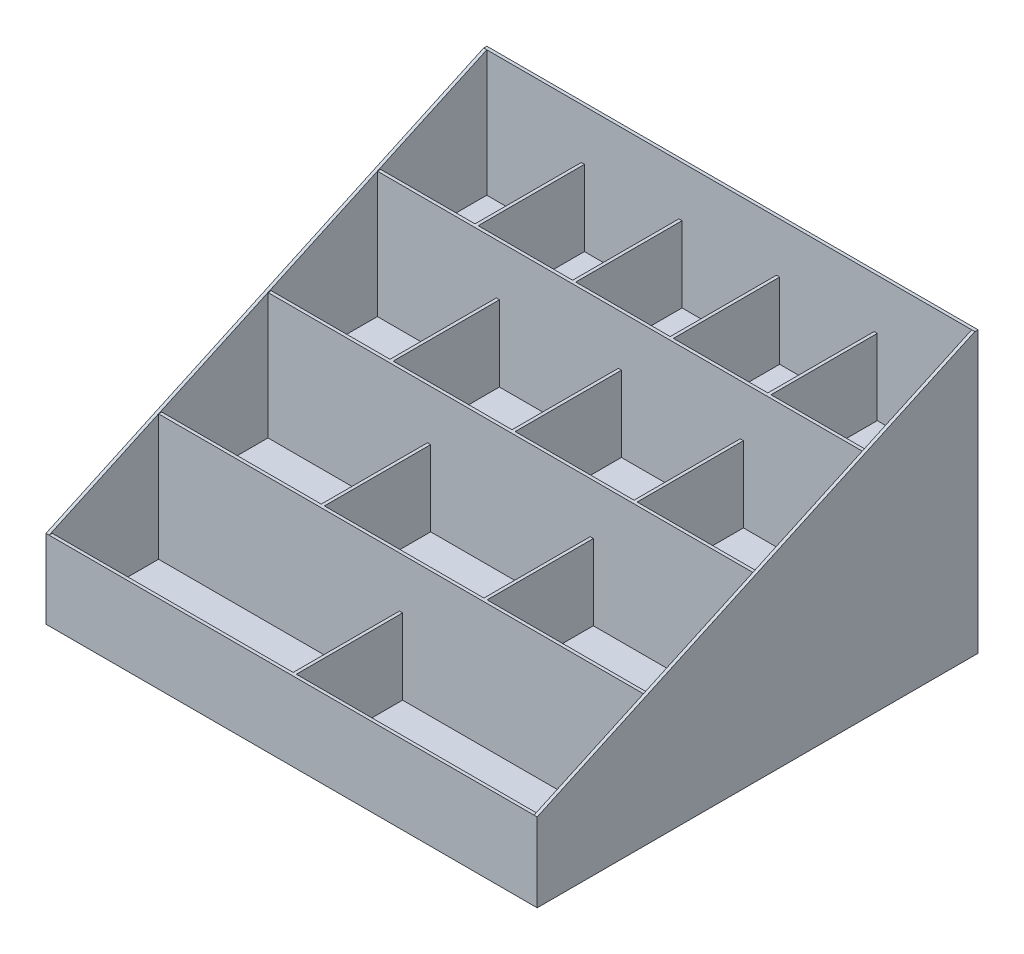
from build123d import *

# Parameters (mm, degrees)
BOSS_EXTRUDE1_DEPTH = 123.825
SKETCH3_W           = 121.44375
SKETCH3_H           = 53.578125
CUT_EXTRUDE1_DEPTH  = 38.1
SKETCH4_W           = 80.433333333
SKETCH4_H           = 53.578125
SKETCH4_W_2         = 80.433333334
CUT_EXTRUDE2_DEPTH  = 38.1
SKETCH5_W           = 59.928125
SKETCH5_H           = 53.578125
CUT_EXTRUDE3_DEPTH  = 38.1
SKETCH6_W           = 47.625
SKETCH6_H           = 53.578125
CUT_EXTRUDE4_DEPTH  = 38.1
BOSS_EXTRUDE2_DEPTH = 1.5875


with BuildPart() as part:
    # Sketch1 → Boss-Extrude1 (new, symmetric)
    with BuildSketch(Plane(origin=(0, 0, 0), x_dir=(0, 0, -1), z_dir=(1, 0, 0))):
        Polygon((0, 0), (222.25, 0), (222.25, 115.8875), (222.25, 141.2875), (220.6625, 141.2875), (220.6625, 115.8875), (165.496875, 115.8875), (165.496875, 90.4875), (110.33125, 90.4875), (110.33125, 65.0875), (55.165625, 65.0875), (55.165625, 39.6875), (0, 39.6875), (0, 14.2875), align=None)
    extrude(amount=BOSS_EXTRUDE1_DEPTH, both=True)

    # Sketch3 → Cut-Extrude1 (cut)
    with BuildSketch(Plane(origin=(0, 39.6875, 0), x_dir=(1, 0, 0), z_dir=(0, 1, 0))):
        with Locations((-61.515625, 28.3765625)):
            Rectangle(SKETCH3_W, SKETCH3_H)
        with Locations((61.515625, 28.3765625)):
            Rectangle(SKETCH3_W, SKETCH3_H)
    extrude(amount=-CUT_EXTRUDE1_DEPTH, mode=Mode.SUBTRACT)

    # Sketch4 → Cut-Extrude2 (cut)
    with BuildSketch(Plane(origin=(0, 65.0875, 0), x_dir=(1, 0, 0), z_dir=(0, 1, 0))):
        with Locations((-82.020833334, 83.5421875)):
            Rectangle(SKETCH4_W, SKETCH4_H)
        with Locations((0, 83.5421875)):
            Rectangle(SKETCH4_W_2, SKETCH4_H)
        with Locations((82.020833334, 83.5421875)):
            Rectangle(SKETCH4_W, SKETCH4_H)
    extrude(amount=-CUT_EXTRUDE2_DEPTH, mode=Mode.SUBTRACT)

    # Sketch5 → Cut-Extrude3 (cut)
    with BuildSketch(Plane(origin=(0, 90.4875, 0), x_dir=(1, 0, 0), z_dir=(0, 1, 0))):
        with Locations((-92.2734375, 138.7078125)):
            Rectangle(SKETCH5_W, SKETCH5_H)
        with Locations((-30.7578125, 138.7078125)):
            Rectangle(SKETCH5_W, SKETCH5_H)
        with Locations((30.7578125, 138.7078125)):
            Rectangle(SKETCH5_W, SKETCH5_H)
        with Locations((92.2734375, 138.7078125)):
            Rectangle(SKETCH5_W, SKETCH5_H)
    extrude(amount=-CUT_EXTRUDE3_DEPTH, mode=Mode.SUBTRACT)

    # Sketch6 → Cut-Extrude4 (cut)
    with BuildSketch(Plane(origin=(0, 115.8875, 0), x_dir=(1, 0, 0), z_dir=(0, 1, 0))):
        with Locations((-98.425, 193.8734375)):
            Rectangle(SKETCH6_W, SKETCH6_H)
        with Locations((-49.2125, 193.8734375)):
            Rectangle(SKETCH6_W, SKETCH6_H)
        with Locations((0, 193.8734375)):
            Rectangle(SKETCH6_W, SKETCH6_H)
        with Locations((49.2125, 193.8734375)):
            Rectangle(SKETCH6_W, SKETCH6_H)
        with Locations((98.425, 193.8734375)):
            Rectangle(SKETCH6_W, SKETCH6_H)
    extrude(amount=-CUT_EXTRUDE4_DEPTH, mode=Mode.SUBTRACT)

    # Sketch7 → Boss-Extrude2 (add)
    with BuildSketch(Plane(origin=(123.825, 0, 0), x_dir=(0, 0, -1), z_dir=(1, 0, 0))):
        Polygon((0, 39.6875), (220.6625, 141.2875), (220.6625, 39.6875), align=None)
    boss_extrude2 = extrude(amount=-BOSS_EXTRUDE2_DEPTH)

    # Mirror1: Boss-Extrude2 across plane
    add(boss_extrude2.mirror(Plane(origin=(0, 0, 0), x_dir=(0, 0, 1), z_dir=(1, 0, 0))))


solid = part.part
